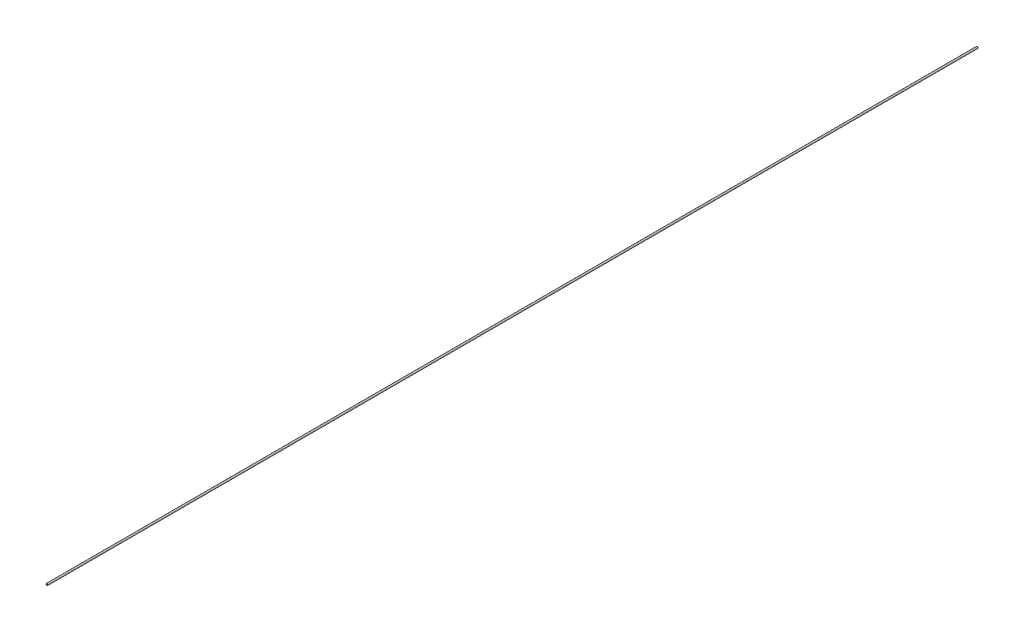
from build123d import *

# Parameters (mm, degrees)
ESQUISSE1_R        = 6
BOSS_EXTRU_1_DEPTH = 6250
CONG_1_R           = 2


with BuildPart() as part:
    # Esquisse1 → Boss.-Extru.1 (new body)
    with BuildSketch(Plane.XY):
        Circle(ESQUISSE1_R)
    extrude(amount=BOSS_EXTRU_1_DEPTH)

    # Congé1
    cong_1_edges = [part.edges().sort_by_distance(p)[0] for p in [
        (-6, 0, 0),
        (-6, 0, 6250),
    ]]
    fillet(cong_1_edges, radius=CONG_1_R)


solid = part.part
